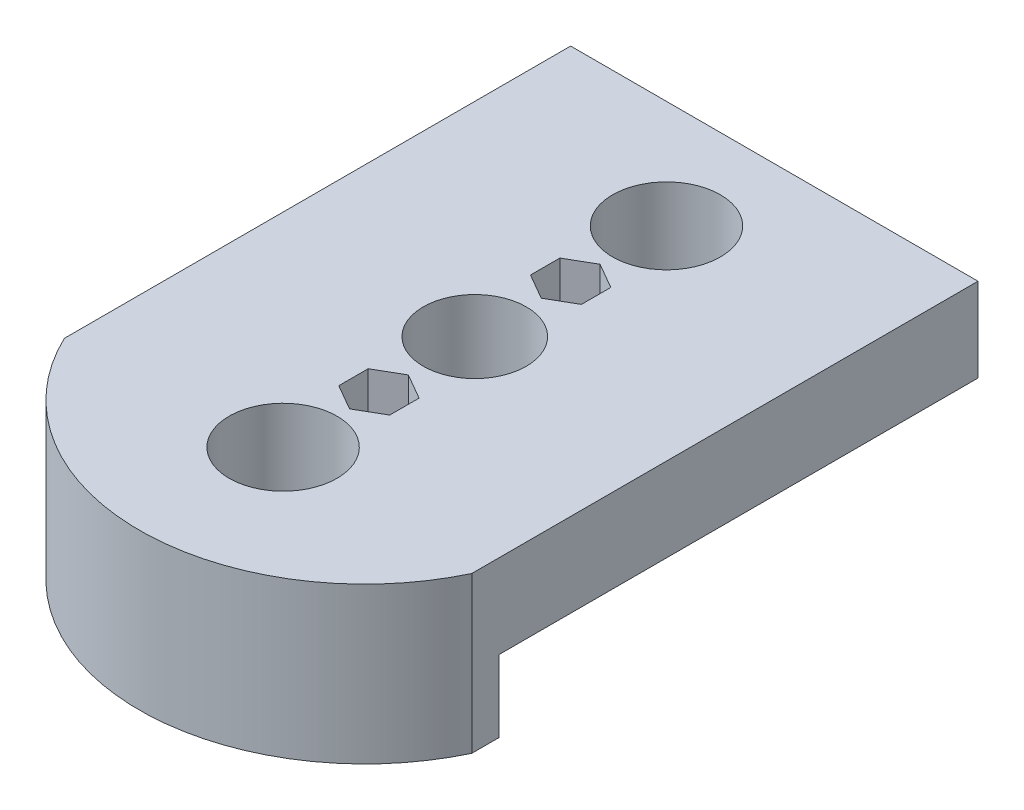
from build123d import *

# Parameters (mm, degrees)
SKETCH1_W           = 34
SKETCH1_H           = 58
BOSS_EXTRUDE1_DEPTH = 13
SKETCH3_W           = 4.5
SKETCH3_H           = 13
CUT_EXTRUDE1_DEPTH  = 2.7
SKETCH5_R           = 4.3
CUT_EXTRUDE2_DEPTH  = 36.158071619
SKETCH12_W          = 4.5
SKETCH12_H          = 13
CUT_EXTRUDE3_DEPTH  = 45
CUT_EXTRUDE4_DEPTH  = 37.041642582
SKETCH9_R           = 1.05
CUT_EXTRUDE6_DEPTH  = 13
CUT_EXTRUDE7_DEPTH  = 5.5
SKETCH13_W          = 34
SKETCH13_H          = 5
CUT_EXTRUDE8_DEPTH  = 15


with BuildPart() as part:
    # Sketch1 → Boss-Extrude1 (new body)
    with BuildSketch(Plane(origin=(0, 0, 0), x_dir=(1, 0, 0), z_dir=(0, 1, 0))):
        Rectangle(SKETCH1_W, SKETCH1_H)
    extrude(amount=BOSS_EXTRUDE1_DEPTH)

    # Sketch3 → Cut-Revolve1 (revolve, cut)
    with BuildSketch(Plane(origin=(0, 0, 0), x_dir=(0, 0, -1), z_dir=(1, 0, 0)), mode=Mode.PRIVATE) as cut_revolve1_sk:
        with Locations((-14.75, 6.5)):
            Rectangle(SKETCH3_W, SKETCH3_H)
    revolve(cut_revolve1_sk.sketch.rotate(Axis((0, 13, 17), (0, -1, 0)), 180), axis=Axis((0, 13, 17), (0, -1, 0)), mode=Mode.SUBTRACT)

    # Sketch4 → Cut-Extrude1 (cut)
    with BuildSketch(Plane.XZ):
        Polygon((3.70947548, -5.425), (7.418950959, 1), (3.70947548, 7.425), (-3.70947548, 7.425), (-7.418950959, 1), (-3.70947548, -5.425), align=None)
    extrude(amount=-CUT_EXTRUDE1_DEPTH, mode=Mode.SUBTRACT)

    # Sketch5 → Cut-Extrude2 (cut, through all)
    with BuildSketch(Plane.XZ.offset(-2.7)):
        with Locations(Location((0, 1, 0), (0, 0, 270))):
            Circle(SKETCH5_R)
    extrude(amount=-CUT_EXTRUDE2_DEPTH, mode=Mode.SUBTRACT)

    # Sketch12 → Cut-Revolve2 (revolve, cut)
    with BuildSketch(Plane(origin=(0, 0, 0), x_dir=(0, 0, -1), z_dir=(1, 0, 0))):
        with Locations((17.25, 6.5)):
            Rectangle(SKETCH12_W, SKETCH12_H)
    revolve(axis=Axis((0, 0, -15), (0, 1, 0)), mode=Mode.SUBTRACT)

    # Sketch6 → Cut-Extrude3 (cut)
    with BuildSketch(Plane(origin=(0, 0, -29), x_dir=(-1, 0, 0), z_dir=(0, 0, -1))):
        Polygon((-17, 6), (-14, 6), (-14, 9), (-6.699377385, 9), (-8.8, 6), (-8.8, 0), (-17, 0), align=None)
        Polygon((8.8, 0), (17, 0), (17, 6), (14, 6), (14, 9), (6.699377385, 9), (8.8, 6), align=None)
    extrude(amount=-CUT_EXTRUDE3_DEPTH, mode=Mode.SUBTRACT)

    # Sketch7 → Cut-Extrude4 (cut, through all)
    with BuildSketch(Plane(origin=(0, 13, 0), x_dir=(1, 0, 0), z_dir=(0, 1, 0))):
        with BuildLine():
            Line((17, -29), (17, -18.253317763))
            ThreePointArc((17, -18.253317763), (10.05598304, -26.088042865), (1.4e-08, -29))
            Line((1.4e-08, -29), (17, -29))
        make_face()
        with BuildLine():
            Line((-17, -29), (1.4e-08, -29))
            ThreePointArc((1.4e-08, -29), (-10.055983028, -26.088042873), (-17, -18.253317763))
            Line((-17, -18.253317763), (-17, -29))
        make_face()
    extrude(amount=-CUT_EXTRUDE4_DEPTH, mode=Mode.SUBTRACT)

    # Sketch9 → Cut-Extrude6 (cut)
    with BuildSketch(Plane.XZ):
        with Locations(Location((0, -7, 0), (0, 0, 270))):
            Circle(SKETCH9_R)
        with Locations(Location((0, 9, 0), (0, 0, 270))):
            Circle(SKETCH9_R)
    extrude(amount=-CUT_EXTRUDE6_DEPTH, mode=Mode.SUBTRACT)

    # Sketch10 → Cut-Extrude7 (cut)
    with BuildSketch(Plane(origin=(0, 13, 0), x_dir=(1, 0, 0), z_dir=(0, 1, 0))):
        Polygon((0, -6.546261356), (-2.125, -7.773130678), (-2.125, -10.226869322), (0, -11.453738644), (2.125, -10.226869322), (2.125, -7.773130678), align=None)
        Polygon((0, 9.453738644), (-2.125, 8.226869322), (-2.125, 5.773130678), (0, 4.546261356), (2.125, 5.773130678), (2.125, 8.226869322), align=None)
    extrude(amount=-CUT_EXTRUDE7_DEPTH, mode=Mode.SUBTRACT)

    # Sketch13 → Cut-Extrude8 (cut)
    with BuildSketch(Plane(origin=(0, 13, 0), x_dir=(1, 0, 0), z_dir=(0, 1, 0))):
        with Locations((0, 26.5)):
            Rectangle(SKETCH13_W, SKETCH13_H)
    extrude(amount=-CUT_EXTRUDE8_DEPTH, mode=Mode.SUBTRACT)


solid = part.part
